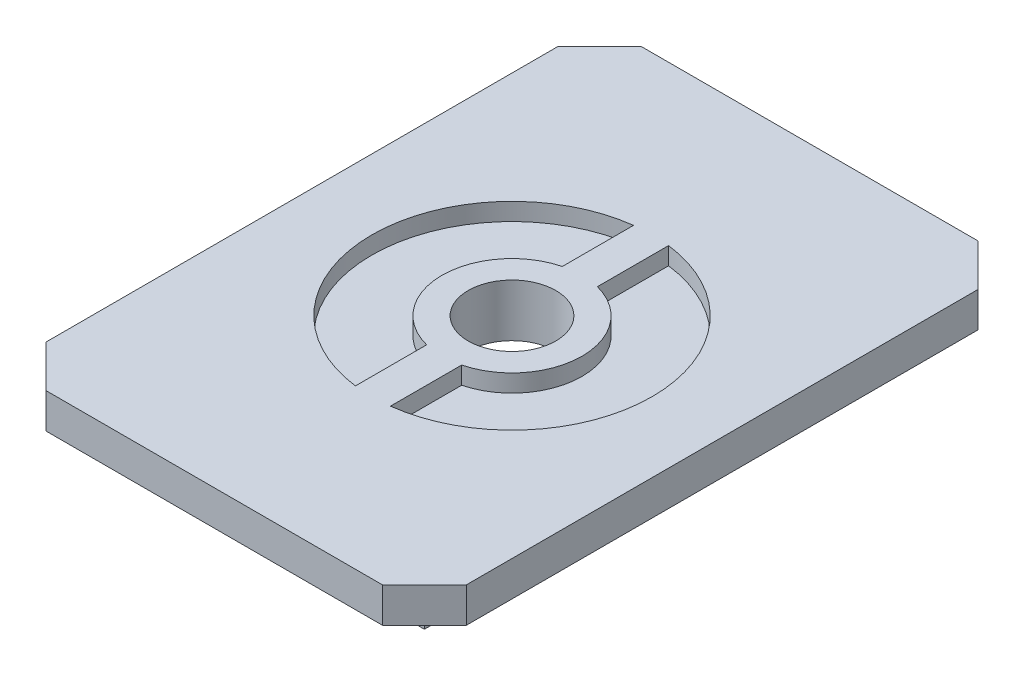
from build123d import *

# Parameters (mm, degrees)
SKETCH1_W           = 38.1
SKETCH1_H           = 53.975
BOSS_EXTRUDE1_DEPTH = 3.175
SKETCH2_W           = 31.75
SKETCH2_H           = 47.625
BOSS_EXTRUDE2_DEPTH = 1.5875
CHAMFER1_SIZE       = 3.81
SKETCH3_R           = 1.905
CUT_EXTRUDE1_DEPTH  = 1.5875
SKETCH4_R           = 3.96875
CUT_EXTRUDE2_DEPTH  = 125.151898589


with BuildPart() as part:
    # Sketch1 → Boss-Extrude1 (new body)
    with BuildSketch(Plane(origin=(0, 0, 0), x_dir=(1, 0, 0), z_dir=(0, 1, 0))):
        with Locations((-73.117016369, -56.056184953)):
            Rectangle(SKETCH1_W, SKETCH1_H)
    extrude(amount=BOSS_EXTRUDE1_DEPTH)

    # Sketch2 → Boss-Extrude2 (add)
    with BuildSketch(Plane.XZ):
        with Locations((-73.117016369, 56.056184953)):
            Rectangle(SKETCH2_W, SKETCH2_H)
    extrude(amount=BOSS_EXTRUDE2_DEPTH)

    # Chamfer1
    chamfer1_edges = [part.edges().sort_by_distance(p)[0] for p in [
        (-92.167016369, 1.5875, 29.068684953),
        (-54.067016369, 1.5875, 29.068684953),
        (-54.067016369, 1.5875, 83.043684953),
        (-92.167016369, 1.5875, 83.043684953),
    ]]
    chamfer(chamfer1_edges, length=CHAMFER1_SIZE)

    # Sketch3 → Cut-Extrude1 (cut)
    with BuildSketch(Plane(origin=(0, 3.175, 0), x_dir=(1, 0, 0), z_dir=(0, 1, 0))):
        with Locations(Location((-73.117016369, -56.056184953, 0), (0, 0, 270))):
            Circle(SKETCH3_R)
        with BuildLine():
            Line((-74.704516369, -68.656575572), (-74.704516369, -62.204546015))
            ThreePointArc((-74.704516369, -62.204546015), (-79.467016369, -56.056184953), (-74.704516369, -49.907823891))
            Line((-74.704516369, -49.907823891), (-74.704516369, -43.455794334))
            ThreePointArc((-74.704516369, -43.455794334), (-85.817016369, -56.056184953), (-74.704516369, -68.656575572))
        make_face()
        with BuildLine():
            ThreePointArc((-71.529516369, -49.907823891), (-66.767016369, -56.056184953), (-71.529516369, -62.204546015))
            Line((-71.529516369, -62.204546015), (-71.529516369, -68.656575572))
            ThreePointArc((-71.529516369, -68.656575572), (-60.417016369, -56.056184953), (-71.529516369, -43.455794334))
            Line((-71.529516369, -43.455794334), (-71.529516369, -49.907823891))
        make_face()
    extrude(amount=-CUT_EXTRUDE1_DEPTH, mode=Mode.SUBTRACT)

    # Sketch4 → Cut-Extrude2 (cut, through all)
    with BuildSketch(Plane(origin=(0, 3.175, 0), x_dir=(-1, 0, 0), z_dir=(0, 1, 0))):
        with Locations(Location((73.117016369, 56.056184953, 0), (0, 0, 90))):
            Circle(SKETCH4_R)
    extrude(amount=-CUT_EXTRUDE2_DEPTH, mode=Mode.SUBTRACT)


solid = part.part
